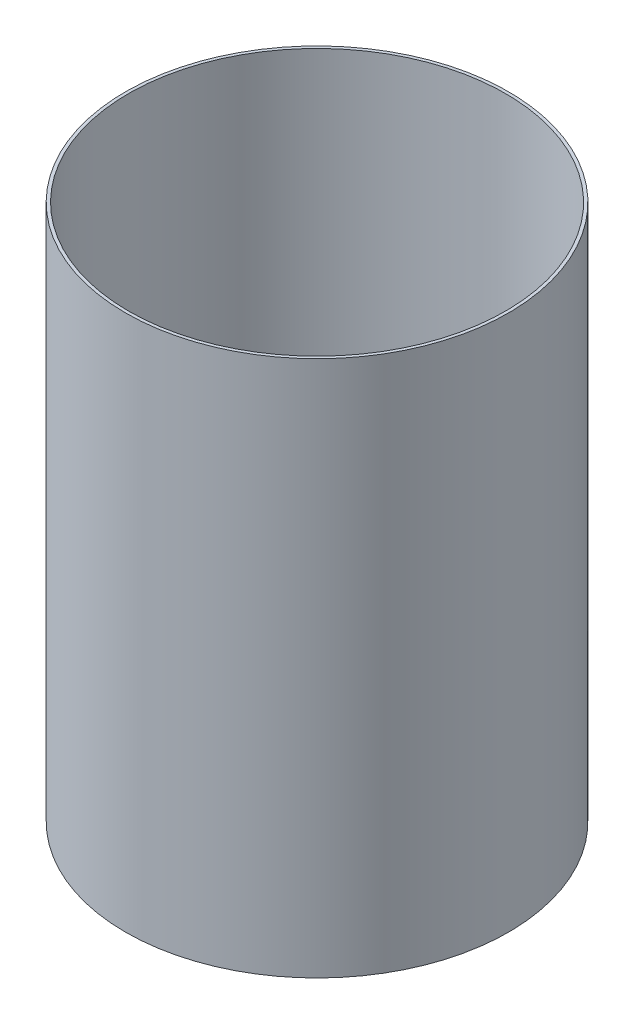
from build123d import *

# Parameters (mm, degrees)
SKETCH1_R           = 62.5
SKETCH1_R_2         = 61.5
BOSS_EXTRUDE1_DEPTH = 87.5


with BuildPart() as part:
    # Sketch1 → Boss-Extrude1 (new, symmetric)
    with BuildSketch(Plane(origin=(0, 0, 0), x_dir=(1, 0, 0), z_dir=(0, 1, 0))):
        with Locations(Location((0, 0, 0), (0, 0, 270))):
            Circle(SKETCH1_R)
        with Locations(Location((0, 0, 0), (0, 0, 270))):
            Circle(SKETCH1_R_2, mode=Mode.SUBTRACT)
    extrude(amount=BOSS_EXTRUDE1_DEPTH, both=True)


solid = part.part
